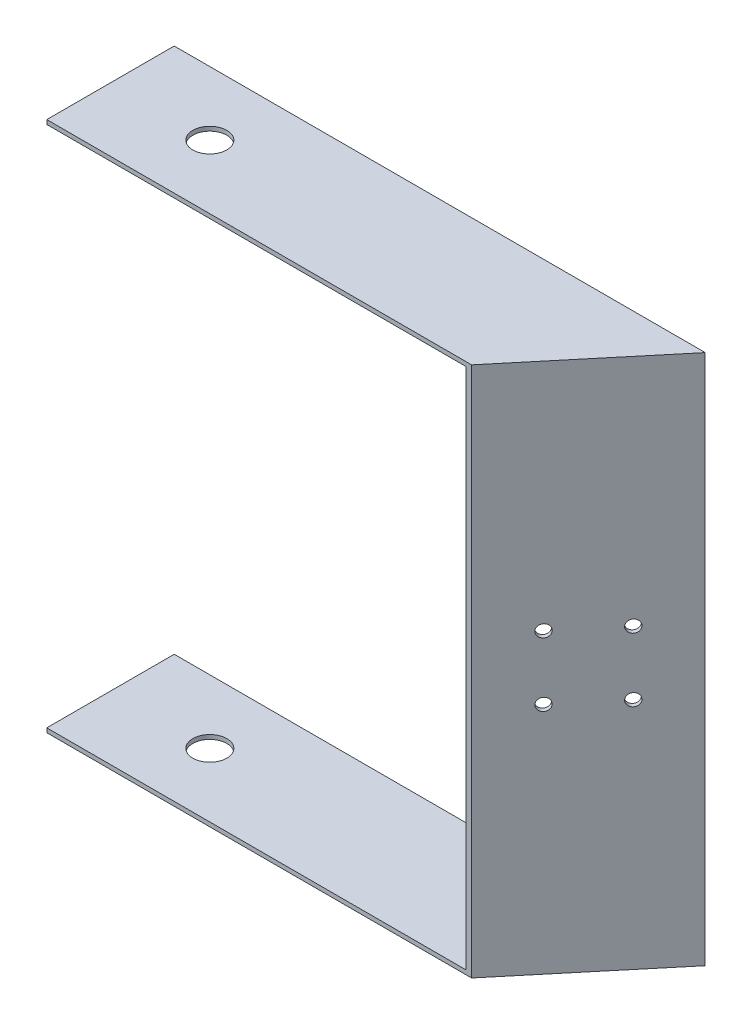
from build123d import *

# Parameters (mm, degrees)
SKETCH1_W           = 125
SKETCH1_H           = 125
BOSS_EXTRUDE1_DEPTH = 30
CUT_EXTRUDE1_DEPTH  = 125
SHELL1_T            = -1
SKETCH3_R           = 4
CUT_EXTRUDE2_DEPTH  = 125
CUT_EXTRUDE3_DEPTH  = 125


with BuildPart() as part:
    # Sketch1 → Boss-Extrude1 (new body)
    with BuildSketch(Plane.XY):
        with Locations((62.5, 62.5)):
            Rectangle(SKETCH1_W, SKETCH1_H)
    extrude(amount=BOSS_EXTRUDE1_DEPTH)

    # Sketch2 → Cut-Extrude1 (cut)
    with BuildSketch(Plane(origin=(0, 125, 0), x_dir=(1, 0, 0), z_dir=(0, 1, 0))):
        Polygon((125, 0), (100, -30), (125, -30), align=None)
    extrude(amount=-CUT_EXTRUDE1_DEPTH, mode=Mode.SUBTRACT)

    # Shell1
    shell1_openings = [part.faces().sort_by_distance(p)[0] for p in [
        (50, 62.5, 30),
        (62.5, 62.5, 0),
        (0, 62.5, 15),
    ]]
    offset(amount=SHELL1_T, openings=shell1_openings, kind=Kind.INTERSECTION)

    # Sketch3 → Cut-Extrude2 (cut)
    with BuildSketch(Plane(origin=(0, 0, 0), x_dir=(-1, 0, 0), z_dir=(0, -1, 0))):
        with Locations(Location((-23.380174368, -15, 0), (0, 0, 90))):
            Circle(SKETCH3_R)
    extrude(amount=-CUT_EXTRUDE2_DEPTH, mode=Mode.SUBTRACT)

    # Sketch4 → Cut-Extrude3 (cut)
    with BuildSketch(Plane(origin=(73.770491803, 0, 61.475409836), x_dir=(0.6401843996644799, 0, -0.7682212795973759), z_dir=(0.768221279597376, 0, 0.6401843996644799))):
        with BuildLine():
            Line((52.997425768, 68.55), (52.997425768, 70))
            Line((52.997425768, 70), (54.447425768, 70))
            ThreePointArc((54.447425768, 70), (51.972120936, 71.025304833), (52.997425768, 68.55))
        make_face()
        with BuildLine():
            Line((54.447425768, 70), (52.997425768, 70))
            Line((52.997425768, 70), (52.997425768, 68.55))
            ThreePointArc((52.997425768, 68.55), (54.022730601, 68.974695167), (54.447425768, 70))
        make_face()
        with BuildLine():
            ThreePointArc((69.447425768, 70), (67.997425768, 71.45), (66.547425768, 70))
            Line((66.547425768, 70), (67.997425768, 70))
            Line((67.997425768, 70), (67.997425768, 68.55))
            ThreePointArc((67.997425768, 68.55), (69.022730601, 68.974695167), (69.447425768, 70))
        make_face()
        with BuildLine():
            Line((67.997425768, 70), (66.547425768, 70))
            ThreePointArc((66.547425768, 70), (66.972120936, 68.974695167), (67.997425768, 68.55))
            Line((67.997425768, 68.55), (67.997425768, 70))
        make_face()
        with BuildLine():
            ThreePointArc((54.447425768, 55), (54.022730601, 56.025304833), (52.997425768, 56.45))
            Line((52.997425768, 56.45), (52.997425768, 55))
            Line((52.997425768, 55), (54.447425768, 55))
        make_face()
        with BuildLine():
            Line((52.997425768, 55), (52.997425768, 56.45))
            ThreePointArc((52.997425768, 56.45), (51.972120936, 53.974695167), (54.447425768, 55))
            Line((54.447425768, 55), (52.997425768, 55))
        make_face()
        with BuildLine():
            ThreePointArc((69.447425768, 55), (69.022730601, 56.025304833), (67.997425768, 56.45))
            Line((67.997425768, 56.45), (67.997425768, 55))
            Line((67.997425768, 55), (66.547425768, 55))
            ThreePointArc((66.547425768, 55), (67.997425768, 53.55), (69.447425768, 55))
        make_face()
        with BuildLine():
            Line((67.997425768, 55), (67.997425768, 56.45))
            ThreePointArc((67.997425768, 56.45), (66.972120936, 56.025304833), (66.547425768, 55))
            Line((66.547425768, 55), (67.997425768, 55))
        make_face()
    extrude(amount=-CUT_EXTRUDE3_DEPTH, mode=Mode.SUBTRACT)


solid = part.part
